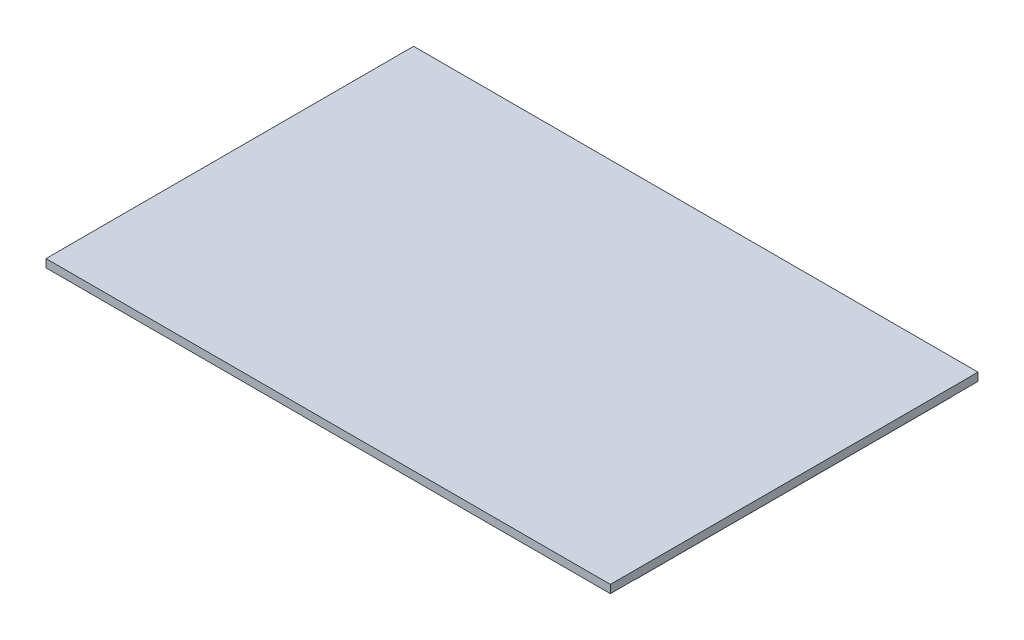
from build123d import *

# Parameters (mm, degrees)
SKETCH1_W           = 111.125
SKETCH1_H           = 72.39
BOSS_EXTRUDE1_DEPTH = 1.5875
SKETCH2_W           = 111.125
SKETCH2_H           = 62.23
BOSS_EXTRUDE2_DEPTH = 0.0508


with BuildPart() as part:
    # Sketch1 → Boss-Extrude1 (new body)
    with BuildSketch(Plane(origin=(0, 0, 0), x_dir=(1, 0, 0), z_dir=(0, 1, 0))):
        with Locations((55.5625, 36.195)):
            Rectangle(SKETCH1_W, SKETCH1_H)
    extrude(amount=BOSS_EXTRUDE1_DEPTH)


with BuildPart() as body_2:
    # Sketch2 → Boss-Extrude2 (new body)
    with BuildSketch(Plane.XZ):
        with Locations((55.5625, -36.195)):
            Rectangle(SKETCH2_W, SKETCH2_H)
    extrude(amount=BOSS_EXTRUDE2_DEPTH)


solid = Compound([part.part, body_2.part])
